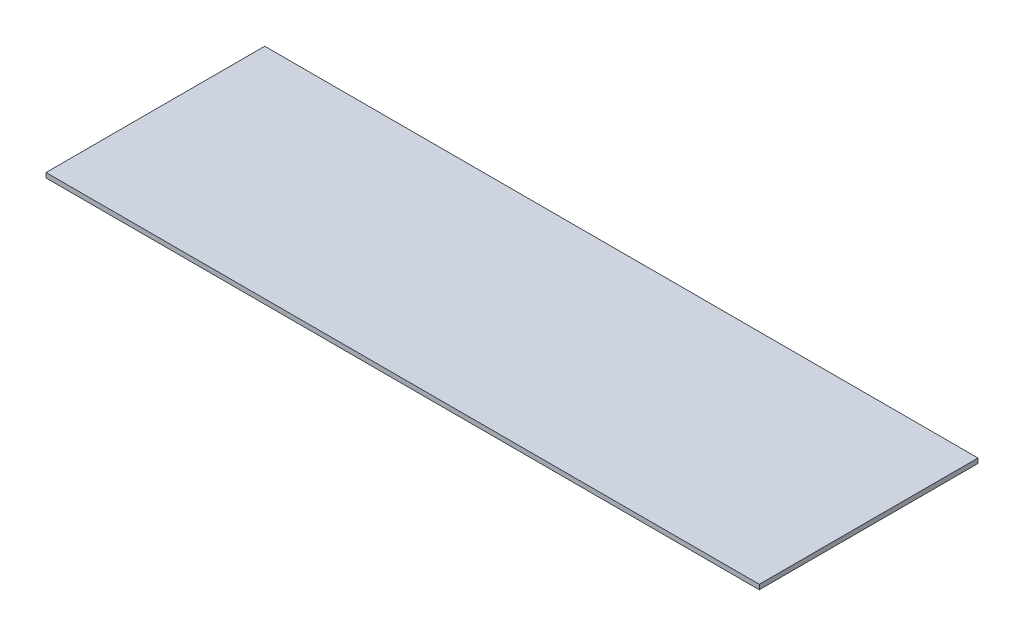
from build123d import *

# Parameters (mm, degrees)
SKETCH1_W           = 476.25
SKETCH1_H           = 146.05
BOSS_EXTRUDE1_DEPTH = 3.175


with BuildPart() as part:
    # Sketch1 → Boss-Extrude1 (new body)
    with BuildSketch(Plane(origin=(0, 0, 0), x_dir=(1, 0, 0), z_dir=(0, 1, 0))):
        with Locations((149.003927171, -17.29107535)):
            Rectangle(SKETCH1_W, SKETCH1_H)
    extrude(amount=BOSS_EXTRUDE1_DEPTH)


solid = part.part
